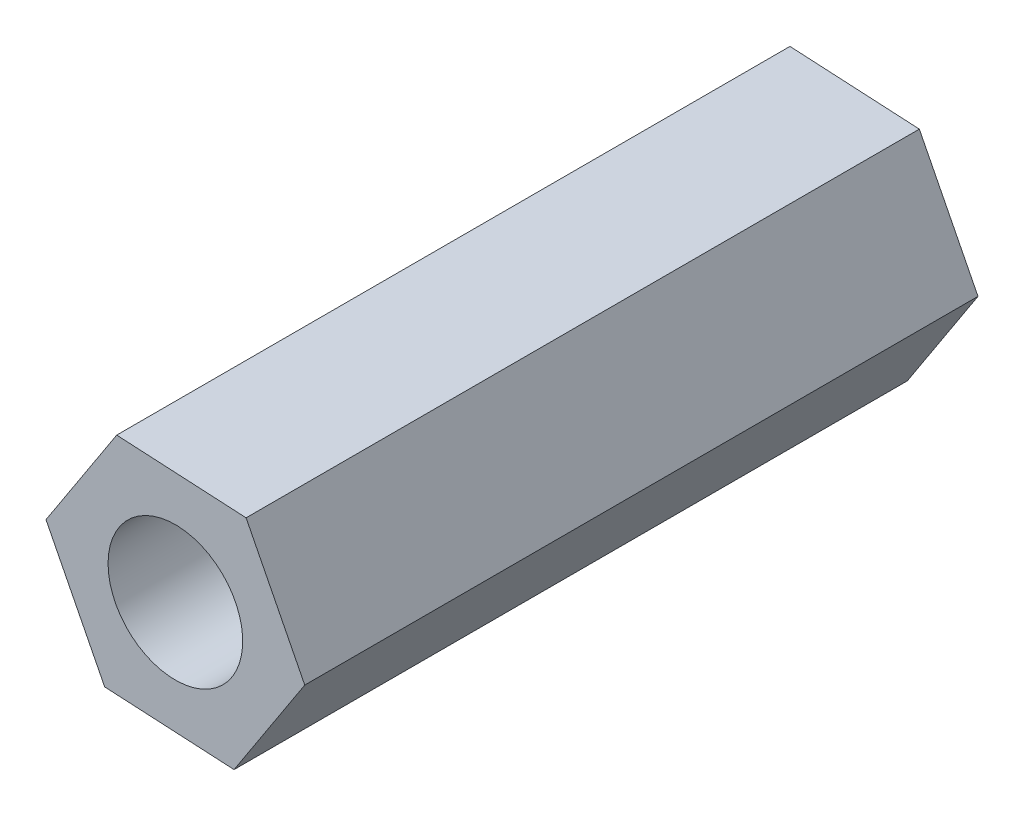
from build123d import *

# Parameters (mm, degrees)
BOSS_EXTRUDE1_DEPTH = 15
SKETCH2_R           = 1.5
CUT_EXTRUDE1_DEPTH  = 16.489805259


with BuildPart() as part:
    # Sketch1 → Boss-Extrude1 (new body)
    with BuildSketch(Plane.XY):
        Polygon((1.57545706, 2.418939517), (-1.307134542, 2.573855595), (-2.882591602, 0.154916078), (-1.57545706, -2.418939517), (1.307134542, -2.573855595), (2.882591602, -0.154916078), align=None)
    extrude(amount=BOSS_EXTRUDE1_DEPTH)

    # Sketch2 → Cut-Extrude1 (cut, through all)
    with BuildSketch(Plane(origin=(0, 0, 0), x_dir=(-1, 0, 0), z_dir=(0, 0, -1))):
        Circle(SKETCH2_R)
    extrude(amount=-CUT_EXTRUDE1_DEPTH, mode=Mode.SUBTRACT)


solid = part.part
